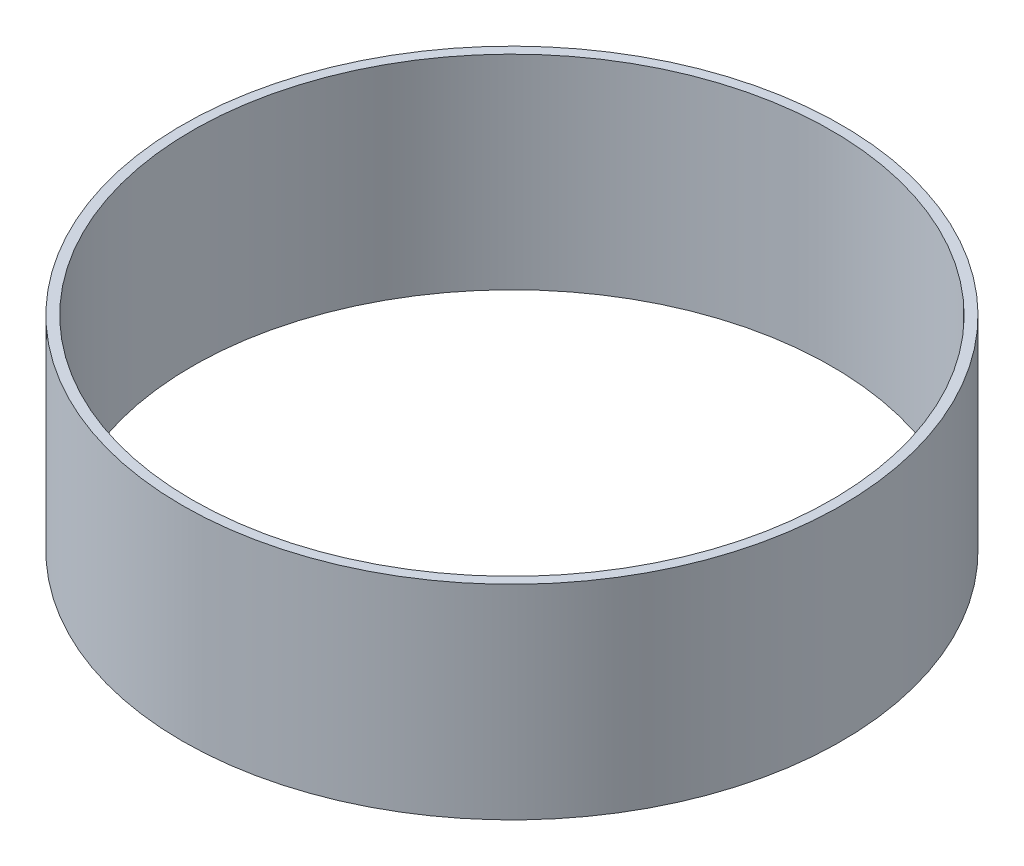
from build123d import *

# Parameters (mm, degrees)
BOSS_EXTRUDE1_DEPTH      = 25
BOSS_EXTRUDE1_DEPTH_BACK = 25
SKETCH1_R                = 80.75
SKETCH1_R_2              = 78.35


with BuildPart() as part:
    # Sketch1 → Boss-Extrude1 (new, two sides: drawn at the far end of the back side and taken through both)
    with BuildSketch(Plane(origin=(0, 0, 0), x_dir=(1, 0, 0), z_dir=(0, 1, 0)).offset(-BOSS_EXTRUDE1_DEPTH_BACK)):
        with Locations(Location((0, 0, 0), (0, 0, 270))):
            Circle(SKETCH1_R)
        with Locations(Location((0, 0, 0), (0, 0, 270))):
            Circle(SKETCH1_R_2, mode=Mode.SUBTRACT)
    extrude(amount=BOSS_EXTRUDE1_DEPTH + BOSS_EXTRUDE1_DEPTH_BACK)


solid = part.part
